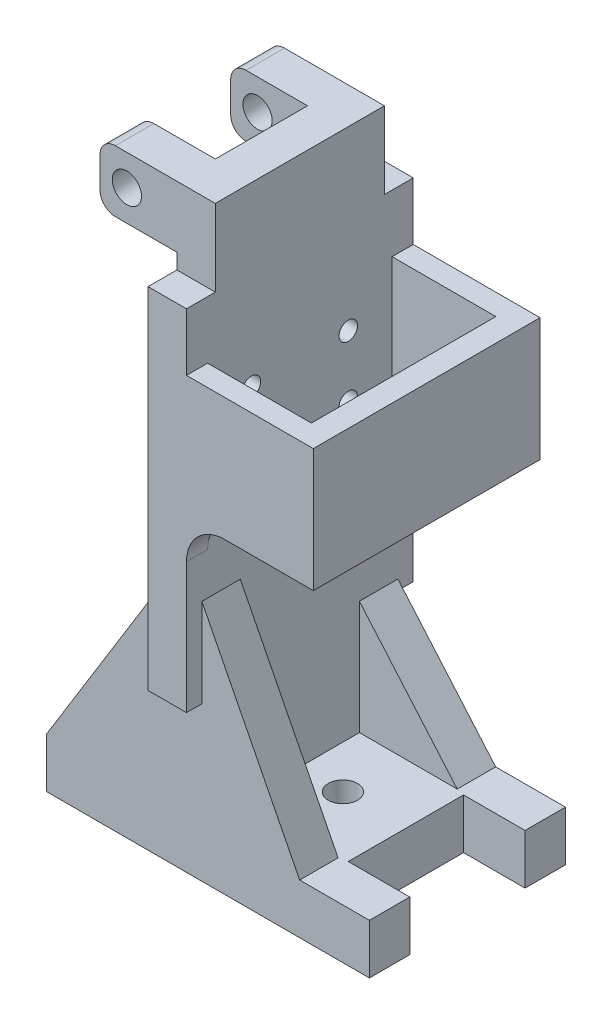
from build123d import *

# Parameters (mm, degrees)
ESQUISSE1_W                = 42
ESQUISSE1_H                = 25.5
BOSS_EXTRU_1_DEPTH         = 6.5
ESQUISSE2_W                = 16
ESQUISSE2_H                = 15
ENL_V_MAT_EXTRU_1_DEPTH    = 10
ESQUISSE3_W                = 5
ESQUISSE3_H                = 25.5
BOSS_EXTRU_2_DEPTH         = 13.5
ESQUISSE6_W                = 5
ESQUISSE6_H                = 29.5
BOSS_EXTRU_3_DEPTH         = 45.5
ESQUISSE4_R                = 1.2
ENL_V_MAT_EXTRU_3_DEPTH    = 45.5
BOSS_EXTRU_4_START         = 22
BOSS_EXTRU_4_DEPTH         = 16
CONG_2_R                   = 5
BOSS_EXTRU_5_DEPTH         = 5
ESQUISSE10_R               = 1.9
ENL_V_MAT_EXTRU_5_DEPTH    = 17
ESQUISSE11_W               = 20
ESQUISSE11_H               = 5
BOSS_EXTRU_6_DEPTH         = 4
BOSS_EXTRU_7_DEPTH         = 5
BOSS_EXTRU_8_DEPTH         = 5.25
R_P_TITION_LIN_AIRE1_COUNT = 2
R_P_TITION_LIN_AIRE1_PITCH = 20.25
ESQUISSE15_W               = 5
ESQUISSE15_H               = 22
BOSS_EXTRU_9_DEPTH         = 10
ESQUISSE16_R               = 1.9
BOSS_EXTRU_10_DEPTH        = 5
R_P_TITION_LIN_AIRE2_COUNT = 2
R_P_TITION_LIN_AIRE2_PITCH = 17


with BuildPart() as part:
    # Esquisse1 → Boss.-Extru.1 (new body)
    with BuildSketch(Plane(origin=(0, 0, 0), x_dir=(1, 0, 0), z_dir=(0, 1, 0))):
        Rectangle(ESQUISSE1_W, ESQUISSE1_H)
    extrude(amount=BOSS_EXTRU_1_DEPTH)

    # Esquisse2 → Enlèv. mat.-Extru.1 (cut)
    with BuildSketch(Plane(origin=(0, 0, 0), x_dir=(1, 0, 0), z_dir=(0, 1, 0))):
        with Locations((-21, 0)):
            Rectangle(ESQUISSE2_W, ESQUISSE2_H)
        with Locations((21, 0)):
            Rectangle(ESQUISSE2_W, ESQUISSE2_H)
    extrude(amount=ENL_V_MAT_EXTRU_1_DEPTH, mode=Mode.SUBTRACT)

    # Esquisse3 → Boss.-Extru.2 (add)
    with BuildSketch(Plane(origin=(0, 6.5, 0), x_dir=(1, 0, 0), z_dir=(0, 1, 0))):
        with Locations((-3.3, 0)):
            Rectangle(ESQUISSE3_W, ESQUISSE3_H)
    extrude(amount=BOSS_EXTRU_2_DEPTH)

    # Esquisse6 → Boss.-Extru.3 (add)
    with BuildSketch(Plane(origin=(0, 20, 0), x_dir=(1, 0, 0), z_dir=(0, 1, 0))):
        with Locations((-3.3, 0)):
            Rectangle(ESQUISSE6_W, ESQUISSE6_H)
    extrude(amount=BOSS_EXTRU_3_DEPTH)

    # Esquisse4 → Enlèv. mat.-Extru.3 (cut)
    with BuildSketch(Plane(origin=(-0.8, 0, 0), x_dir=(0, 0, -1), z_dir=(1, 0, 0))):
        with Locations((-6.3, 52.5)):
            Circle(ESQUISSE4_R)
        with Locations((6.3, 52.5)):
            Circle(ESQUISSE4_R)
        with Locations((6.3, 44.5)):
            Circle(ESQUISSE4_R)
        with Locations((-6.3, 44.5)):
            Circle(ESQUISSE4_R)
    extrude(amount=-ENL_V_MAT_EXTRU_3_DEPTH, mode=Mode.SUBTRACT)

    # Esquisse5 → Boss.-Extru.4 (add)
    with BuildSketch(Plane(origin=(0, 20, 0), x_dir=(1, 0, 0), z_dir=(0, 1, 0)).offset(BOSS_EXTRU_4_START)):
        Polygon((-0.8, 14.75), (-0.8, 12), (12.7, 12), (12.7, -12), (-0.8, -12), (-0.8, -14.75), (15.7, -14.75), (15.7, 14.75), align=None)
    extrude(amount=BOSS_EXTRU_4_DEPTH)

    # Congé2
    cong_2_edges = [part.edges().sort_by_distance(p)[0] for p in [
        (-0.8, 42, 13.375),
        (-0.8, 42, -13.375),
    ]]
    fillet(cong_2_edges, radius=CONG_2_R)

    # Esquisse9 → Boss.-Extru.5 (add)
    with BuildSketch(Plane.XY.offset(12.75)):
        Polygon((-0.8, 22.034425492), (-0.8, 6.5), (11.926120582, 6.5), (-0.8, 31.53809605), align=None)
    extrude(amount=-BOSS_EXTRU_5_DEPTH)

    # Esquisse10 → Enlèv. mat.-Extru.5 (cut)
    with BuildSketch(Plane(origin=(0, 6.5, 0), x_dir=(1, 0, 0), z_dir=(0, 1, 0))):
        with Locations(Location((-9.199739461, 0, 0), (0, 0, 270))):
            Circle(ESQUISSE10_R)
        with Locations(Location((4.800260539, 0, 0), (0, 0, 270))):
            Circle(ESQUISSE10_R)
    extrude(amount=-ENL_V_MAT_EXTRU_5_DEPTH, mode=Mode.SUBTRACT)

    # Esquisse11 → Boss.-Extru.6 (add)
    with BuildSketch(Plane.ZY.offset(5.8)):
        with Locations((0, 37.55)):
            Rectangle(ESQUISSE11_W, ESQUISSE11_H)
    extrude(amount=BOSS_EXTRU_6_DEPTH)

    # Esquisse12 → Boss.-Extru.7 (add)
    with BuildSketch(Plane(origin=(0, 0, -12.75), x_dir=(-1, 0, 0), z_dir=(0, 0, -1))):
        Polygon((0.8, 21.304240475), (-11.926120582, 6.5), (0.8, 6.5), align=None)
    extrude(amount=-BOSS_EXTRU_7_DEPTH)

    # Esquisse13 → Boss.-Extru.8 (add)
    with BuildSketch(Plane.XY.offset(12.75)):
        Polygon((-21, 6.5), (-5.8, 31.179013399), (-5.8, 6.5), align=None)
    boss_extru_8 = extrude(amount=-BOSS_EXTRU_8_DEPTH)

    # Répétition linéaire1: Boss.-Extru.8 ×2
    with Locations(*[(0, 0, -i * R_P_TITION_LIN_AIRE1_PITCH) for i in range(1, R_P_TITION_LIN_AIRE1_COUNT)]):
        add(boss_extru_8)

    # Esquisse15 → Boss.-Extru.9 (add)
    with BuildSketch(Plane(origin=(0, 65.5, 0), x_dir=(1, 0, 0), z_dir=(0, 1, 0))):
        with Locations((-3.3, 0)):
            Rectangle(ESQUISSE15_W, ESQUISSE15_H)
    extrude(amount=BOSS_EXTRU_9_DEPTH)

    # Esquisse16 → Boss.-Extru.10 (add)
    with BuildSketch(Plane.XY.offset(11)):
        with BuildLine():
            Line((-5.8, 75.5), (-5.8, 67.5))
            Line((-5.8, 67.5), (-13.8, 67.5))
            ThreePointArc((-13.8, 67.5), (-15.214213562, 68.085786438), (-15.8, 69.5))
            Line((-15.8, 69.5), (-15.8, 73.5))
            ThreePointArc((-15.8, 73.5), (-15.214213562, 74.914213562), (-13.8, 75.5))
            Line((-13.8, 75.5), (-5.8, 75.5))
        make_face()
        with Locations((-12.3, 71.5)):
            Circle(ESQUISSE16_R, mode=Mode.SUBTRACT)
    boss_extru_10 = extrude(amount=-BOSS_EXTRU_10_DEPTH)

    # Répétition linéaire2: Boss.-Extru.10 ×2
    with Locations(*[(0, 0, -i * R_P_TITION_LIN_AIRE2_PITCH) for i in range(1, R_P_TITION_LIN_AIRE2_COUNT)]):
        add(boss_extru_10)


solid = part.part
